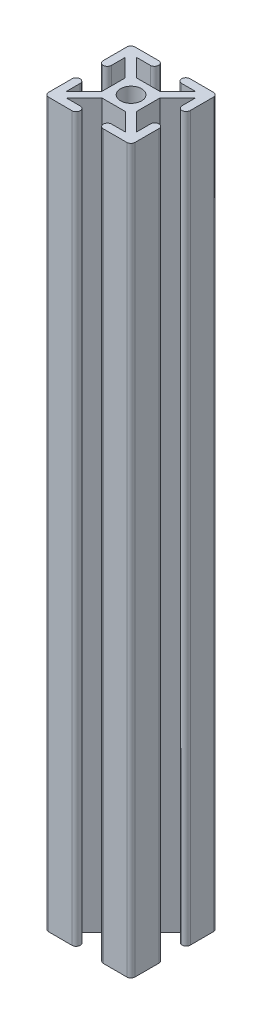
from build123d import *

# Parameters (mm, degrees)
CROQUIS1_R              = 3.645
SALIENTE_EXTRUIR1_DEPTH = 250


with BuildPart() as part:
    # Croquis1 → Saliente-Extruir1 (new body)
    with BuildSketch(Plane(origin=(0, 0, 0), x_dir=(1, 0, 0), z_dir=(0, 1, 0))):
        with BuildLine():
            Line((11.476895811, -6.713360964), (16.201895811, -6.713360964))
            Line((16.201895811, -6.713360964), (10.051895811, -0.563360964))
            Line((10.051895811, -0.563360964), (2.051895811, -0.563360964))
            Line((2.051895811, -0.563360964), (-4.098104189, -6.713360964))
            Line((-4.098104189, -6.713360964), (0.626895811, -6.713360964))
            ThreePointArc((0.626895811, -6.713360964), (2.051895811, -8.138360964), (0.626895811, -9.563360964))
            Line((0.626895811, -9.563360964), (-7.549539962, -9.536925191))
            ThreePointArc((-7.549539962, -9.536925191), (-8.538474211, -9.127295213), (-8.948104189, -8.138360964))
            Line((-8.948104189, -8.138360964), (-8.948104189, 0.011639036))
            ThreePointArc((-8.948104189, 0.011639036), (-7.549539962, 1.410203263), (-6.150975734, 0.011639036))
            Line((-6.150975734, 0.011639036), (-6.150975734, -4.713360964))
            Line((-6.150975734, -4.713360964), (-0.000975734, 1.436639036))
            Line((-0.000975734, 1.436639036), (-0.000975734, 9.436639036))
            Line((-0.000975734, 9.436639036), (-6.150975734, 15.586639036))
            Line((-6.150975734, 15.586639036), (-6.150975734, 10.861639036))
            ThreePointArc((-6.150975734, 10.861639036), (-7.575975734, 9.436639036), (-9.000975734, 10.861639036))
            Line((-9.000975734, 10.861639036), (-9.000975734, 19.011592446))
            ThreePointArc((-9.000975734, 19.011592446), (-8.583602897, 20.019219609), (-7.575975734, 20.436592446))
            Line((-7.575975734, 20.436592446), (0.574024266, 20.436592446))
            ThreePointArc((0.574024266, 20.436592446), (1.999024266, 19.011592446), (0.574024266, 17.586592446))
            Line((0.574024266, 17.586592446), (-4.150975734, 17.586592446))
            Line((-4.150975734, 17.586592446), (1.999024266, 11.436592446))
            Line((1.999024266, 11.436592446), (9.999024266, 11.436592446))
            Line((9.999024266, 11.436592446), (16.149024266, 17.586592446))
            Line((16.149024266, 17.586592446), (11.424024266, 17.586592446))
            ThreePointArc((11.424024266, 17.586592446), (9.999024266, 19.011592446), (11.424024266, 20.436592446))
            Line((11.424024266, 20.436592446), (19.574024266, 20.436592446))
            ThreePointArc((19.574024266, 20.436592446), (20.581651429, 20.019219609), (20.999024266, 19.011592446))
            Line((20.999024266, 19.011592446), (20.999024266, 10.965336131))
            ThreePointArc((20.999024266, 10.965336131), (19.574024266, 9.540336131), (18.149024266, 10.965336131))
            Line((18.149024266, 10.965336131), (18.149024266, 15.586592446))
            Line((18.149024266, 15.586592446), (11.999024266, 9.436592446))
            Line((11.999024266, 9.436592446), (11.999024266, 1.436592446))
            Line((11.999024266, 1.436592446), (18.149024266, -4.713407554))
            Line((18.149024266, -4.713407554), (18.149024266, 0.115336131))
            ThreePointArc((18.149024266, 0.115336131), (19.574024266, 1.540336131), (20.999024266, 0.115336131))
            Line((20.999024266, 0.115336131), (20.999024266, -8.138360964))
            ThreePointArc((20.999024266, -8.138360964), (20.581651429, -9.145988127), (19.574024266, -9.563360964))
            Line((19.574024266, -9.563360964), (11.476895811, -9.563360964))
            ThreePointArc((11.476895811, -9.563360964), (10.051895811, -8.138360964), (11.476895811, -6.713360964))
        make_face()
        with Locations(Location((6.051895811, 5.436639036, 0), (0, 0, 270))):
            Circle(CROQUIS1_R, mode=Mode.SUBTRACT)
    extrude(amount=SALIENTE_EXTRUIR1_DEPTH)


solid = part.part
